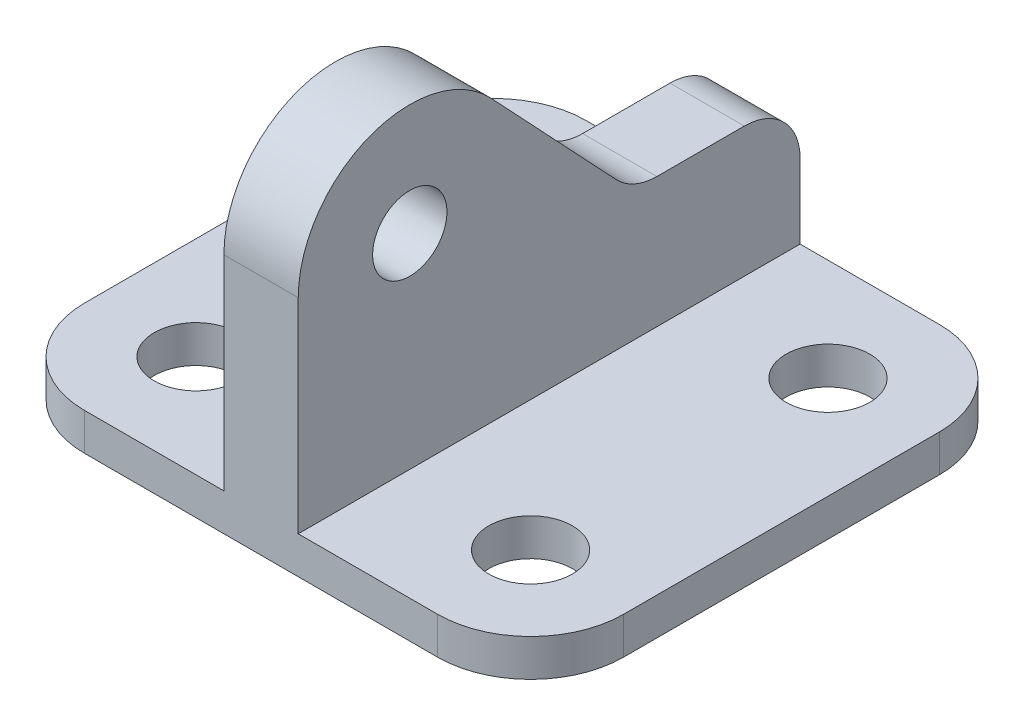
from build123d import *

# Parameters (mm, degrees)
BOSS_EXTRU_1_DEPTH      = 27
CONG_1_R                = 5
ESQUISSE2_R             = 2.25
ENL_V_MAT_EXTRU_1_DEPTH = 44.943145085
ENL_V_MAT_EXTRU_2_DEPTH = 27
CONG_2_R                = 3
ESQUISSE4_R             = 2
ENL_V_MAT_EXTRU_3_DEPTH = 37.908671068


with BuildPart() as part:
    # Esquisse1 → Boss.-Extru.1 (new body)
    with BuildSketch(Plane.XY):
        Polygon((0, 0), (29, 0), (29, 2), (16.5, 2), (16.5, 19), (12.5, 19), (12.5, 2), (0, 2), align=None)
    extrude(amount=BOSS_EXTRU_1_DEPTH)

    # Congé1
    cong_1_edges = [part.edges().sort_by_distance(p)[0] for p in [
        (29, 1, 27),
        (0, 1, 0),
        (0, 1, 27),
        (29, 1, 0),
    ]]
    fillet(cong_1_edges, radius=CONG_1_R)

    # Esquisse2 → Enlèv. mat.-Extru.1 (cut, through all)
    with BuildSketch(Plane.XZ):
        with Locations(Location((5.5, 21.5, 0), (0, 0, 270))):
            Circle(ESQUISSE2_R)
        with Locations(Location((5.5, 5.5, 0), (0, 0, 270))):
            Circle(ESQUISSE2_R)
        with Locations(Location((23.5, 5.5, 0), (0, 0, 270))):
            Circle(ESQUISSE2_R)
        with Locations(Location((23.5, 21.5, 0), (0, 0, 270))):
            Circle(ESQUISSE2_R)
    extrude(amount=-ENL_V_MAT_EXTRU_1_DEPTH, mode=Mode.SUBTRACT)

    # Esquisse3 → Enlèv. mat.-Extru.2 (cut)
    with BuildSketch(Plane.ZY.offset(-12.5)):
        with BuildLine():
            Line((0, 9), (9, 9))
            Line((9, 9), (16.629670691, 17.110987927))
            ThreePointArc((16.629670691, 17.110987927), (23.21111105, 18.577722468), (27, 13))
            Line((27, 13), (29.874608193, 13))
            Line((29.874608193, 13), (29.874608193, 22.034695391))
            Line((29.874608193, 22.034695391), (0, 22.034695391))
            Line((0, 22.034695391), (0, 9))
        make_face()
    extrude(amount=-ENL_V_MAT_EXTRU_2_DEPTH, mode=Mode.SUBTRACT)

    # Congé2
    cong_2_edges = [part.edges().sort_by_distance(p)[0] for p in [
        (14.5, 9, 0),
        (14.5, 9, 9),
    ]]
    fillet(cong_2_edges, radius=CONG_2_R)

    # Esquisse4 → Enlèv. mat.-Extru.3 (cut, through all)
    with BuildSketch(Plane.ZY.offset(-12.5)):
        with Locations((21, 13)):
            Circle(ESQUISSE4_R)
    extrude(amount=-ENL_V_MAT_EXTRU_3_DEPTH, mode=Mode.SUBTRACT)


solid = part.part
